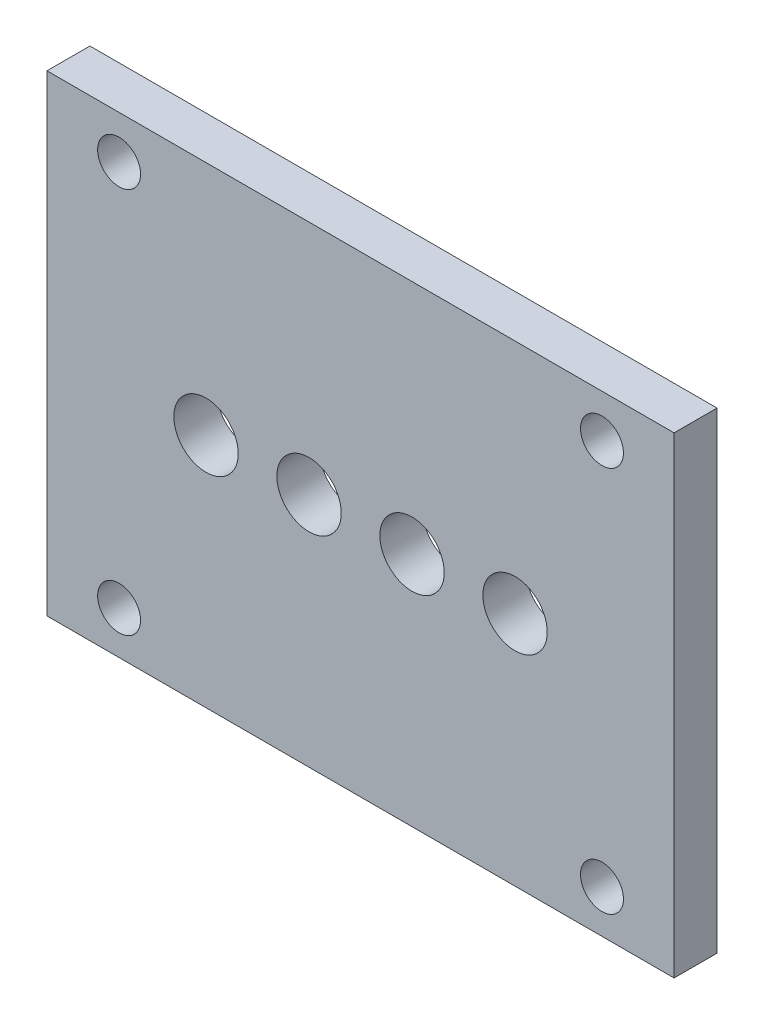
from build123d import *

# Parameters (mm, degrees)
SKETCH1_W           = 185.547
SKETCH1_H           = 139.7
BOSS_EXTRUDE1_DEPTH = 12.7
SKETCH2_R           = 9.525
CUT_EXTRUDE1_DEPTH  = 117.821379902
SKETCH3_R           = 6.35
CUT_EXTRUDE2_DEPTH  = 12.7


with BuildPart() as part:
    # Sketch1 → Boss-Extrude1 (new body)
    with BuildSketch(Plane.XY):
        Rectangle(SKETCH1_W, SKETCH1_H)
    extrude(amount=BOSS_EXTRUDE1_DEPTH)

    # Sketch2 → Cut-Extrude1 (cut, through all)
    with BuildSketch(Plane.XY.offset(12.7)):
        with Locations((-45.72, 0)):
            Circle(SKETCH2_R)
        with Locations((-15.24, 0)):
            Circle(SKETCH2_R)
        with Locations((15.24, 0)):
            Circle(SKETCH2_R)
        with Locations((45.72, 0)):
            Circle(SKETCH2_R)
    extrude(amount=-CUT_EXTRUDE1_DEPTH, mode=Mode.SUBTRACT)

    # Sketch3 → Cut-Extrude2 (cut)
    with BuildSketch(Plane.XY.offset(12.7)):
        with Locations((-71.4375, 57.15)):
            Circle(SKETCH3_R)
        with Locations((-71.4375, -57.15)):
            Circle(SKETCH3_R)
        with Locations((71.4375, 57.15)):
            Circle(SKETCH3_R)
        with Locations((71.4375, -57.15)):
            Circle(SKETCH3_R)
    extrude(amount=-CUT_EXTRUDE2_DEPTH, mode=Mode.SUBTRACT)


solid = part.part
